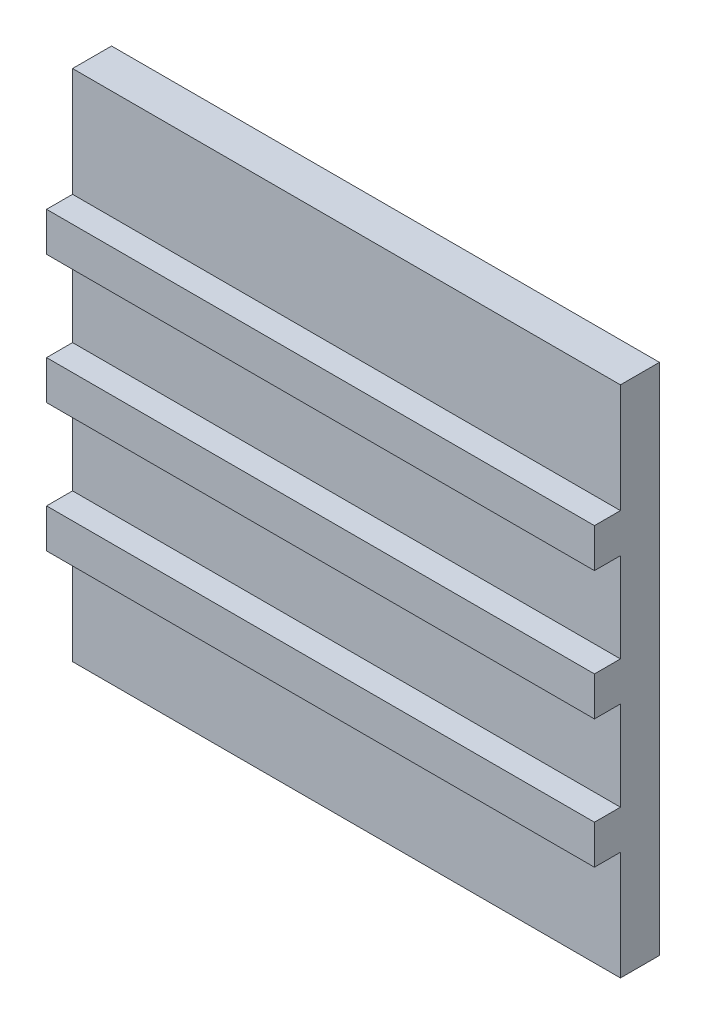
from build123d import *

# Parameters (mm, degrees)
SKETCH2_W           = 42.15
SKETCH2_H           = 39.52
BOSS_EXTRUDE1_DEPTH = 3
BOSS_EXTRUDE2_DEPTH = 2


with BuildPart() as part:
    # Sketch2 → Boss-Extrude1 (new body)
    with BuildSketch(Plane.XY):
        with Locations((-30.591454667, 0.829849509)):
            Rectangle(SKETCH2_W, SKETCH2_H)
    extrude(amount=BOSS_EXTRUDE1_DEPTH)

    # Sketch3 → Boss-Extrude2 (add)
    with BuildSketch(Plane.XY.offset(3)):
        Polygon((-51.666454667, 9.209849509), (-9.516454667, 9.209849509), (-9.516454667, 12.209849509), (-51.666454667, 12.209849509), (-51.666454667, 10.709849509), align=None)
        Polygon((-51.666454667, 0.829849509), (-51.666454667, -0.670150491), (-9.516454667, -0.670150491), (-9.516454667, 2.329849509), (-51.666454667, 2.329849509), align=None)
        Polygon((-51.666454667, -7.550150491), (-51.666454667, -9.050150491), (-51.666454667, -10.550150491), (-9.516454667, -10.550150491), (-9.516454667, -7.550150491), align=None)
    extrude(amount=BOSS_EXTRUDE2_DEPTH)


solid = part.part
